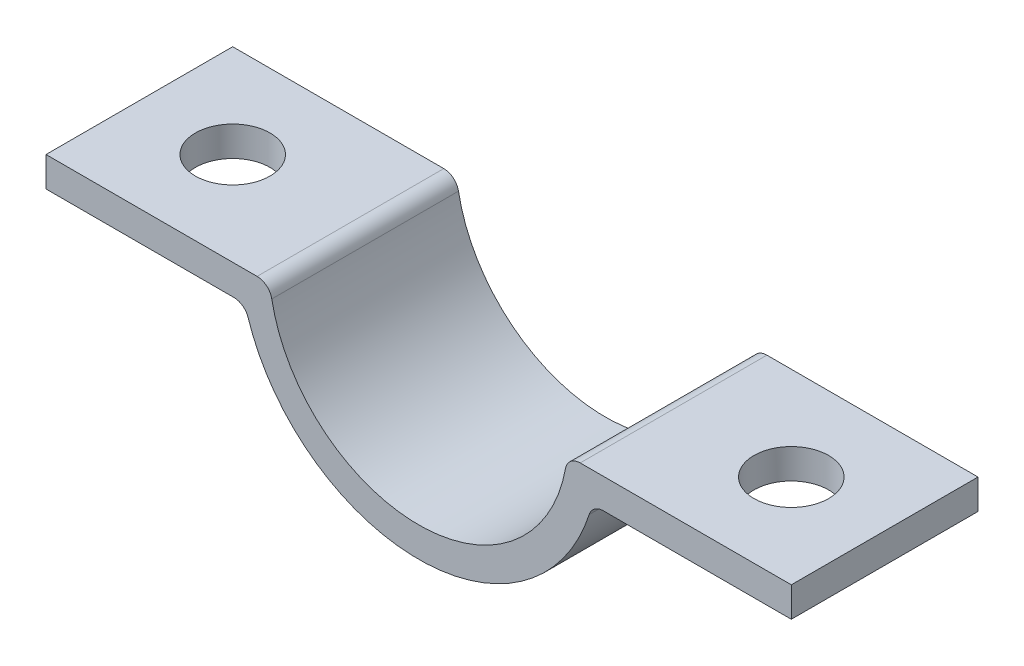
from build123d import *

# Parameters (mm, degrees)
BOSS_EXTRUDE2_DEPTH = 12.5
CUT_EXTRUDE1_REACH  = 31.996
SKETCH4_R           = 2.5


with BuildPart() as part:
    # Sketch3 → Boss-Extrude2 (new body)
    with BuildSketch(Plane.XY):
        with BuildLine():
            Line((-10.816653826, 19.01731952), (-19.949874371, 19.01731952))
            Line((-19.949874371, 19.01731952), (-24.949874371, 19.01731952))
            Line((-24.949874371, 19.01731952), (-24.949874371, 17.01731952))
            Line((-24.949874371, 17.01731952), (-19.949874371, 17.01731952))
            Line((-19.949874371, 17.01731952), (-12.369316877, 17.01731952))
            ThreePointArc((-12.369316877, 17.01731952), (-11.780968471, 16.82592706), (-11.417830963, 16.325011828))
            ThreePointArc((-11.417830963, 16.325011828), (0, 8.01731952), (11.417830963, 16.325011828))
            ThreePointArc((11.417830963, 16.325011828), (11.780968471, 16.82592706), (12.369316877, 17.01731952))
            Line((12.369316877, 17.01731952), (19.949874371, 17.01731952))
            Line((19.949874371, 17.01731952), (24.949874371, 17.01731952))
            Line((24.949874371, 17.01731952), (24.949874371, 19.01731952))
            Line((24.949874371, 19.01731952), (19.949874371, 19.01731952))
            Line((19.949874371, 19.01731952), (10.816653826, 19.01731952))
            ThreePointArc((10.816653826, 19.01731952), (10.177051677, 18.786025635), (9.83332166, 18.199137702))
            ThreePointArc((9.83332166, 18.199137702), (0, 10.01731952), (-9.83332166, 18.199137702))
            ThreePointArc((-9.83332166, 18.199137702), (-10.177051677, 18.786025635), (-10.816653826, 19.01731952))
        make_face()
    extrude(amount=BOSS_EXTRUDE2_DEPTH)

    # Sketch4 → Cut-Extrude1 (cut, up to next)
    with BuildSketch(Plane(origin=(0, 19.01731952, 0), x_dir=(1, 0, 0), z_dir=(0, 1, 0)), mode=Mode.PRIVATE) as cut_extrude1_sk1:
        with Locations(Location((-18.699874371, -6.25, 0), (0, 0, 270))):
            Circle(SKETCH4_R)
    cut_extrude1_tool1 = extrude(cut_extrude1_sk1.sketch, amount=-CUT_EXTRUDE1_REACH, mode=Mode.PRIVATE) & part.part
    # Sketch4 → Cut-Extrude1 (cut, up to next)
    with BuildSketch(Plane(origin=(0, 19.01731952, 0), x_dir=(1, 0, 0), z_dir=(0, 1, 0)), mode=Mode.PRIVATE) as cut_extrude1_sk2:
        with Locations(Location((18.699874371, -6.25, 0), (0, 0, 270))):
            Circle(SKETCH4_R)
    cut_extrude1_tool2 = extrude(cut_extrude1_sk2.sketch, amount=-CUT_EXTRUDE1_REACH, mode=Mode.PRIVATE) & part.part
    add(cut_extrude1_tool1.solids().sort_by_distance((-18.699874, 19.01732, 6.25))[0], mode=Mode.SUBTRACT)
    add(cut_extrude1_tool2.solids().sort_by_distance((18.699874, 19.01732, 6.25))[0], mode=Mode.SUBTRACT)


solid = part.part
